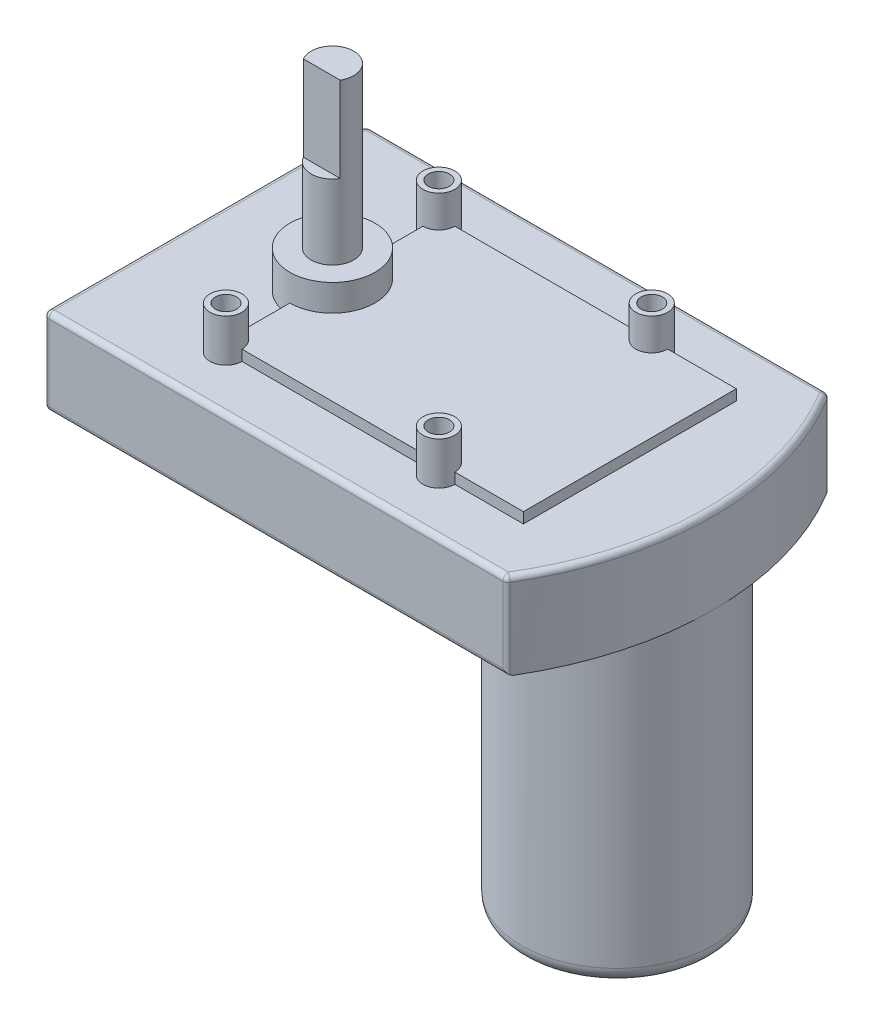
from build123d import *

# Parameters (mm, degrees)
EXTRUDE_1_DEPTH     = 16.2
SKETCH_2_R          = 3
EXTRUDE_2_DEPTH     = 8
SKETCH_3_R          = 2
CUT_EXTRUDE_1_DEPTH = 8
SKETCH_4_R          = 8
EXTRUDE_3_DEPTH     = 7
SKETCH_5_R          = 4
EXTRUDE_4_DEPTH     = 30
CUT_EXTRUDE_START   = -16
CUT_EXTRUDE_2_DEPTH = 16
EXTRUDE_5_DEPTH     = 2
SKETCH_9_R          = 18
EXTRUDE_6_DEPTH     = 57.6
FILLET_1_R          = 3
FILLET_2_R          = 1


with BuildPart() as part:
    # 草图1 → 凸台-拉伸1 (new body)
    with BuildSketch(Plane(origin=(0, 0, 0), x_dir=(1, 0, 0), z_dir=(0, 1, 0))):
        with BuildLine():
            Line((-47.75, 30.25), (39.104556615, 30.25))
            ThreePointArc((39.104556615, 30.25), (47.75, 0), (39.104556615, -30.25))
            Line((39.104556615, -30.25), (-47.75, -30.25))
            Line((-47.75, -30.25), (-47.75, 30.25))
        make_face()
    extrude(amount=EXTRUDE_1_DEPTH)

    # 草图2 → 凸台-拉伸2 (add)
    with BuildSketch(Plane(origin=(0, 16.2, 0), x_dir=(1, 0, 0), z_dir=(0, 1, 0))):
        with Locations(Location((-23.75, -20, 0), (0, 0, 90))):
            Circle(SKETCH_2_R)
        with Locations(Location((16.25, -20, 0), (0, 0, 90))):
            Circle(SKETCH_2_R)
        with Locations(Location((16.25, 20, 0), (0, 0, 90))):
            Circle(SKETCH_2_R)
        with Locations(Location((-23.75, 20, 0), (0, 0, 90))):
            Circle(SKETCH_2_R)
    extrude(amount=EXTRUDE_2_DEPTH)

    # 草图3 → 切除-拉伸1 (cut)
    with BuildSketch(Plane(origin=(0, 24.2, 0), x_dir=(1, 0, 0), z_dir=(0, 1, 0))):
        with Locations(Location((-23.75, -20, 0), (0, 0, 270))):
            Circle(SKETCH_3_R)
        with Locations(Location((16.25, -20, 0), (0, 0, 270))):
            Circle(SKETCH_3_R)
        with Locations(Location((16.25, 20, 0), (0, 0, 270))):
            Circle(SKETCH_3_R)
        with Locations(Location((-23.75, 20, 0), (0, 0, 270))):
            Circle(SKETCH_3_R)
    extrude(amount=-CUT_EXTRUDE_1_DEPTH, mode=Mode.SUBTRACT)

    # 草图4 → 凸台-拉伸3 (add)
    with BuildSketch(Plane(origin=(0, 16.2, 0), x_dir=(1, 0, 0), z_dir=(0, 1, 0))):
        with Locations(Location((-23.75, 0, 0), (0, 0, 90))):
            Circle(SKETCH_4_R)
    extrude(amount=EXTRUDE_3_DEPTH)

    # 草图5 → 凸台-拉伸4 (add)
    with BuildSketch(Plane(origin=(0, 23.2, 0), x_dir=(1, 0, 0), z_dir=(0, 1, 0))):
        with Locations(Location((-23.75, 0, 0), (0, 0, 270))):
            Circle(SKETCH_5_R)
    extrude(amount=EXTRUDE_4_DEPTH)

    # 草图6 → 切除-拉伸2 (cut)
    with BuildSketch(Plane(origin=(0, 53.2, 0), x_dir=(1, 0, 0), z_dir=(0, 1, 0)).offset(CUT_EXTRUDE_START)):
        with BuildLine():
            Line((-27.214101615, -2), (-20.285898385, -2))
            ThreePointArc((-20.285898385, -2), (-23.75, -4), (-27.214101615, -2))
        make_face()
    extrude(amount=CUT_EXTRUDE_2_DEPTH, mode=Mode.SUBTRACT)

    # 草图7 → 凸台-拉伸5 (add)
    with BuildSketch(Plane(origin=(0, 16.2, 0), x_dir=(1, 0, 0), z_dir=(0, 1, 0))):
        Polygon((-23.75, -20), (16.25, -20), (32.139613293, -20), (32.139613293, 20), (16.25, 20), (-23.75, 20), align=None)
    extrude(amount=EXTRUDE_5_DEPTH)

    # 草图9 → 凸台-拉伸6 (add)
    with BuildSketch(Plane.XZ):
        with Locations((29.75, 0)):
            Circle(SKETCH_9_R)
    extrude(amount=EXTRUDE_6_DEPTH)

    # 圆角1
    fillet_1_edges = [part.edges().sort_by_distance(p)[0] for p in [
        (11.75, -57.6, 0),
    ]]
    fillet(fillet_1_edges, radius=FILLET_1_R)

    # 圆角2
    fillet_2_edges = [part.edges().sort_by_distance(p)[0] for p in [
        (47.75, 16.2, 0),
        (-4.322721692, 16.2, -30.25),
        (-47.75, 16.2, 0),
        (-4.322721692, 0, -30.25),
        (-4.322721692, 0, 30.25),
        (-47.75, 0, 0),
        (-47.75, 8.1, -30.25),
        (39.104556615, 8.1, -30.25),
        (39.104556615, 8.1, 30.25),
        (-47.75, 8.1, 30.25),
        (-4.322721692, 16.2, 30.25),
    ]]
    fillet(fillet_2_edges, radius=FILLET_2_R)


solid = part.part
